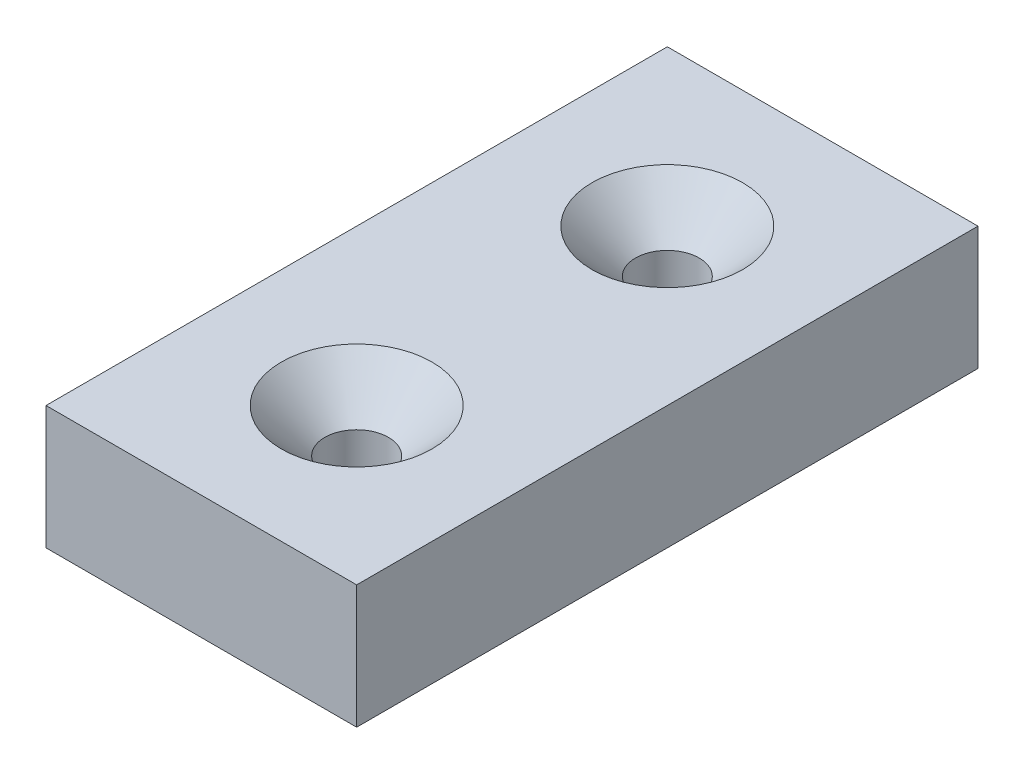
from build123d import *

# Parameters (mm, degrees)
SKETCH1_W           = 20
SKETCH1_H           = 40
SKETCH1_R           = 2.05
BOSS_EXTRUDE1_DEPTH = 7.9375
CHAMFER1_SIZE       = 2.8


with BuildPart() as part:
    # Sketch1 → Boss-Extrude1 (new body)
    with BuildSketch(Plane(origin=(0, -110.068674648, 0), x_dir=(1, 0, 0), z_dir=(0, 1, 0))):
        with Locations((68.333864278, -62.627324848)):
            Rectangle(SKETCH1_W, SKETCH1_H)
        with Locations(Location((68.333864278, -72.627324848, 0), (0, 0, 270))):
            Circle(SKETCH1_R, mode=Mode.SUBTRACT)
        with Locations(Location((68.333864278, -52.627324848, 0), (0, 0, 270))):
            Circle(SKETCH1_R, mode=Mode.SUBTRACT)
    extrude(amount=BOSS_EXTRUDE1_DEPTH)

    # Chamfer1
    chamfer1_edges = [part.edges().sort_by_distance(p)[0] for p in [
        (68.333864278, -102.131174648, 70.577324848),
        (68.333864278, -102.131174648, 50.577324848),
    ]]
    chamfer(chamfer1_edges, length=CHAMFER1_SIZE)


solid = part.part
